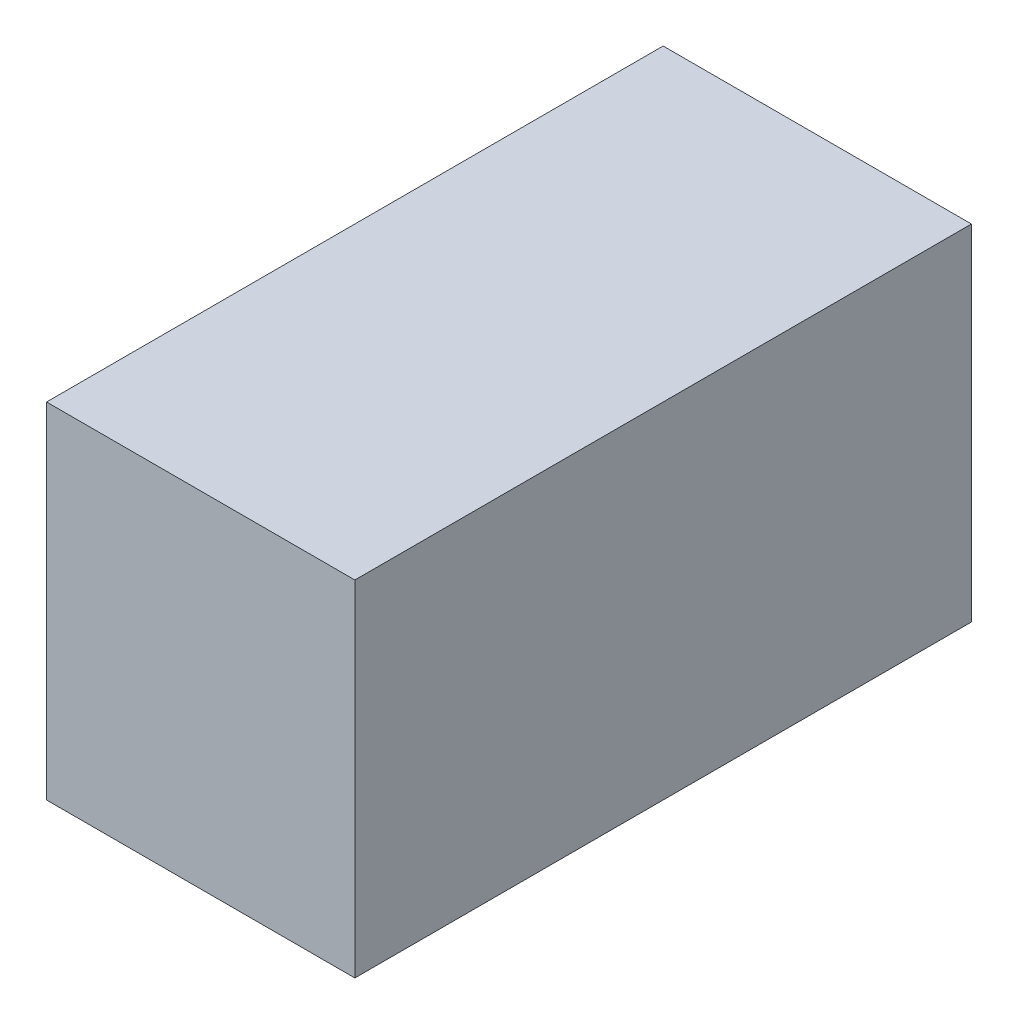
from build123d import *

# Parameters (mm, degrees)
SKETCH1_W           = 50.8
SKETCH1_H           = 101.6
BOSS_EXTRUDE1_DEPTH = 28.4


with BuildPart() as part:
    # Sketch1 → Boss-Extrude1 (new, symmetric)
    with BuildSketch(Plane(origin=(0, 0, 0), x_dir=(1, 0, 0), z_dir=(0, 1, 0))):
        Rectangle(SKETCH1_W, SKETCH1_H)
    extrude(amount=BOSS_EXTRUDE1_DEPTH, both=True)


solid = part.part
